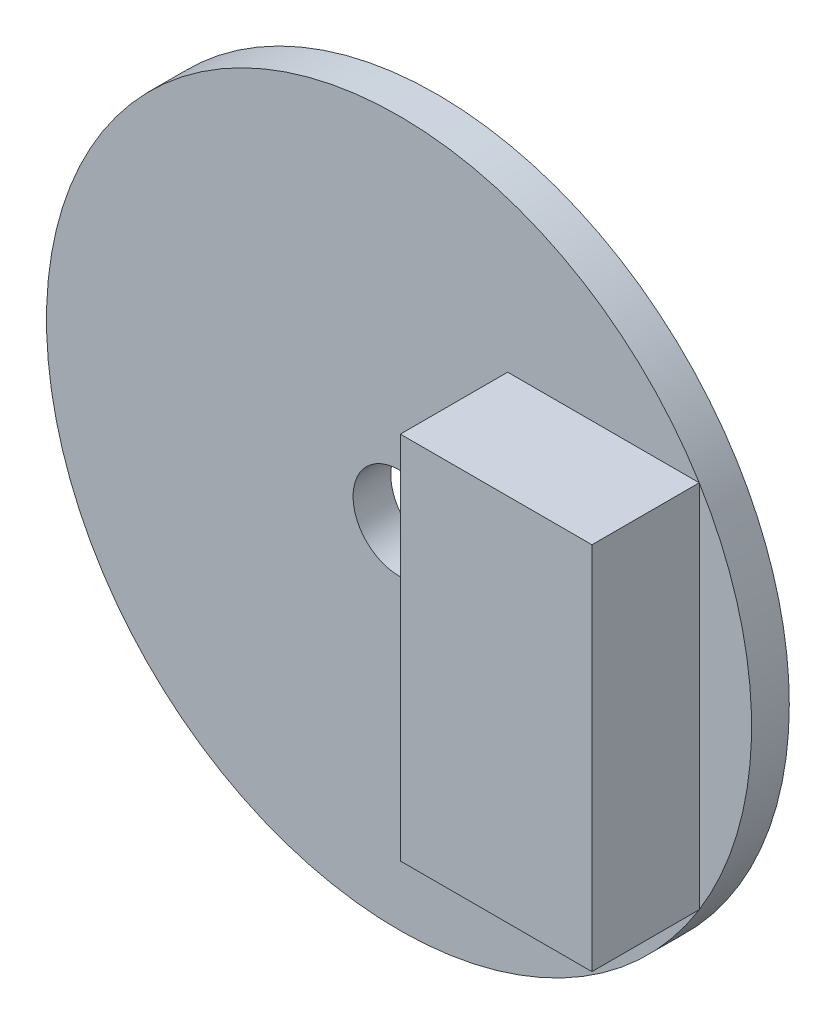
from build123d import *

# Parameters (mm, degrees)
SKETCH1_R           = 11.5
BOSS_EXTRUDE1_DEPTH = 1.23
SKETCH2_W           = 6.25
SKETCH2_H           = 12.059402844
BOSS_EXTRUDE2_DEPTH = 3.5
SKETCH3_R           = 1.5
CUT_EXTRUDE1_DEPTH  = 17.63580476


with BuildPart() as part:
    # Sketch1 → Boss-Extrude1 (new body)
    with BuildSketch(Plane.XY):
        Circle(SKETCH1_R)
    extrude(amount=BOSS_EXTRUDE1_DEPTH)

    # Sketch2 → Boss-Extrude2 (add)
    with BuildSketch(Plane.XY.offset(1.23)):
        with Locations((6.667481849, 0)):
            Rectangle(SKETCH2_W, SKETCH2_H)
    extrude(amount=BOSS_EXTRUDE2_DEPTH)

    # Sketch3 → Cut-Extrude1 (cut, through all)
    with BuildSketch(Plane.XY.offset(1.23)):
        Circle(SKETCH3_R)
    extrude(amount=-CUT_EXTRUDE1_DEPTH, mode=Mode.SUBTRACT)


solid = part.part
